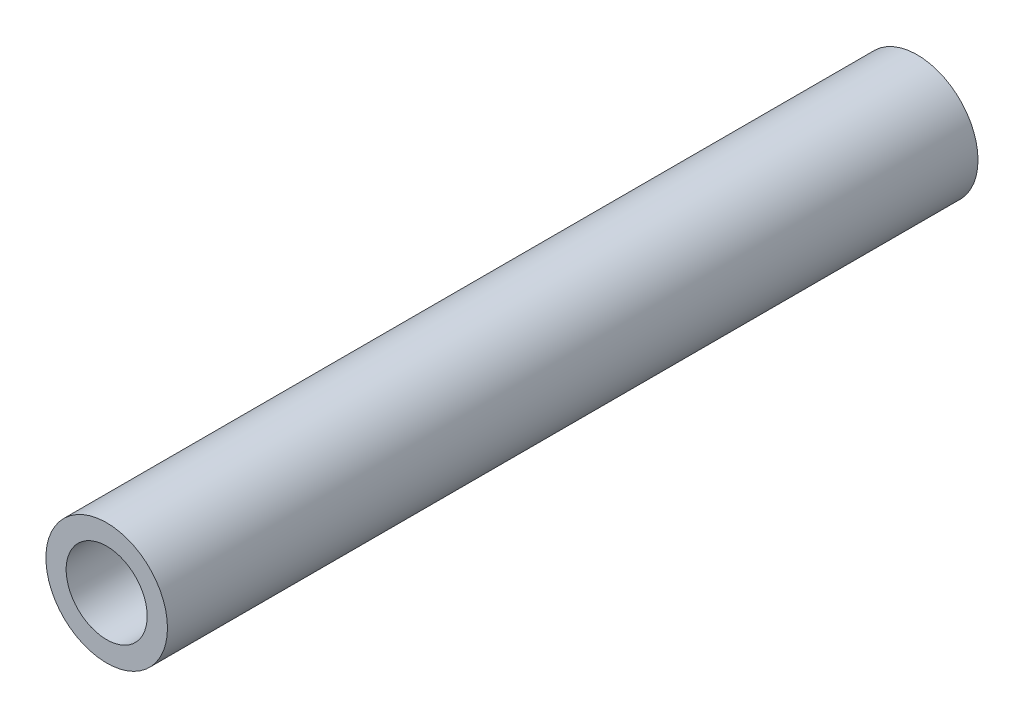
from build123d import *

# Parameters (mm, degrees)
SKETCH_1_R      = 3
SKETCH_1_R_2    = 2
EXTRUDE_1_DEPTH = 20


with BuildPart() as part:
    # 草图1 → 凸台-拉伸1 (new, symmetric)
    with BuildSketch(Plane.XY):
        Circle(SKETCH_1_R)
        Circle(SKETCH_1_R_2, mode=Mode.SUBTRACT)
    extrude(amount=EXTRUDE_1_DEPTH, both=True)


solid = part.part
